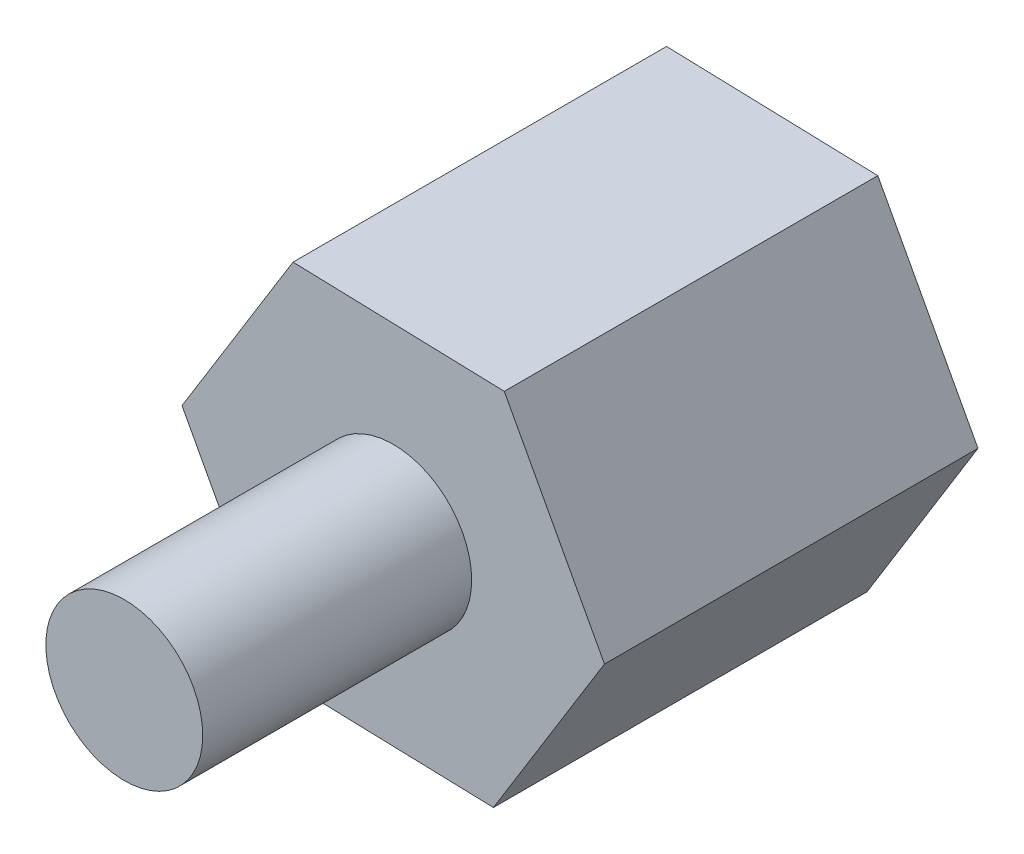
from build123d import *

# Parameters (mm, degrees)
EXTRUDE1_DEPTH = 6.35
SKETCH2_R      = 1.3335
EXTRUDE2_DEPTH = 4.572
SKETCH3_R      = 1.3335
EXTRUDE3_DEPTH = 5.08


with BuildPart() as part:
    # Sketch1 → Extrude1 (new body)
    with BuildSketch(Plane.XY):
        Polygon((1.888017478, 3.056790202), (-1.70324923, 3.163466199), (-3.591266708, 0.106675997), (-1.888017478, -3.056790202), (1.70324923, -3.163466199), (3.591266708, -0.106675997), align=None)
    extrude(amount=EXTRUDE1_DEPTH)

    # Sketch2 → Extrude2 (add)
    with BuildSketch(Plane.XY.offset(6.35)):
        Circle(SKETCH2_R)
    extrude(amount=EXTRUDE2_DEPTH)

    # Sketch3 → Extrude3 (cut)
    with BuildSketch(Plane(origin=(0, 0, 0), x_dir=(-1, 0, 0), z_dir=(0, 0, -1))):
        with Locations(Location((0, 0, 0), (0, 0, 180))):
            Circle(SKETCH3_R)
    extrude(amount=-EXTRUDE3_DEPTH, mode=Mode.SUBTRACT)


solid = part.part
